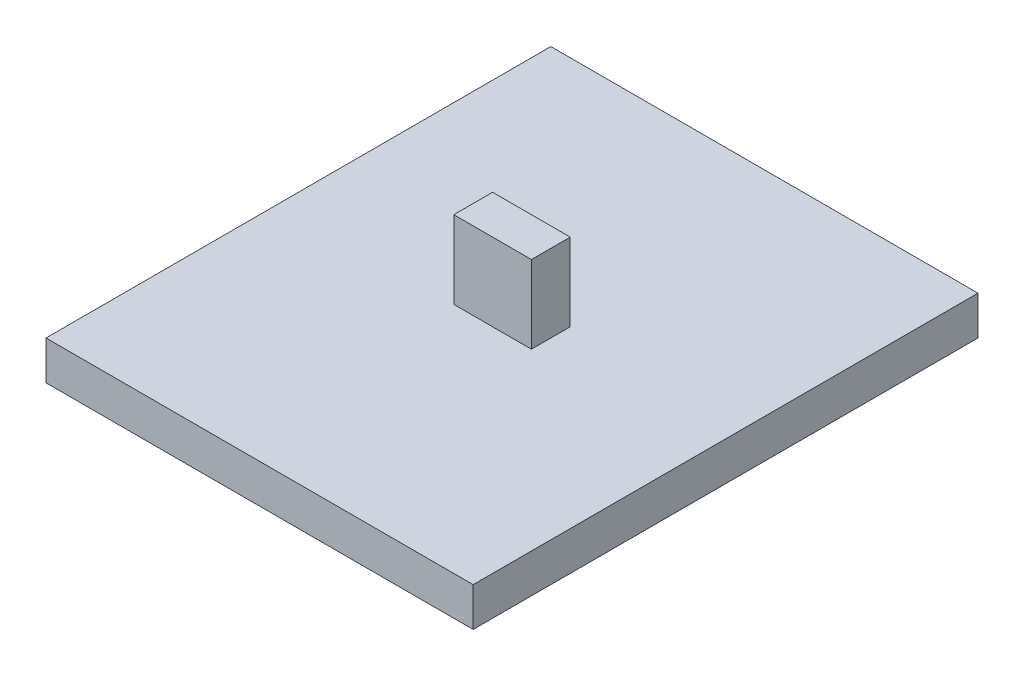
from build123d import *

# Parameters (mm, degrees)
SKETCH1_W           = 69.85
SKETCH1_H           = 6.35
BOSS_EXTRUDE1_DEPTH = 41.275
SHELL1_T            = -2.54
SKETCH2_W           = 12.7
SKETCH2_H           = 12.7
BOSS_EXTRUDE2_DEPTH = 3.175


with BuildPart() as part:
    # Sketch1 → Boss-Extrude1 (new, symmetric)
    with BuildSketch(Plane.XY):
        with Locations((0, 3.175)):
            Rectangle(SKETCH1_W, SKETCH1_H)
    extrude(amount=BOSS_EXTRUDE1_DEPTH, both=True)

    # Shell1
    shell1_openings = [part.faces().sort_by_distance(p)[0] for p in [
        (0, 0, 0),
    ]]
    offset(amount=SHELL1_T, openings=shell1_openings, kind=Kind.INTERSECTION)

    # Sketch2 → Boss-Extrude2 (add, symmetric)
    with BuildSketch(Plane.XY):
        with Locations((0, 12.7)):
            Rectangle(SKETCH2_W, SKETCH2_H)
    extrude(amount=BOSS_EXTRUDE2_DEPTH, both=True)


solid = part.part
